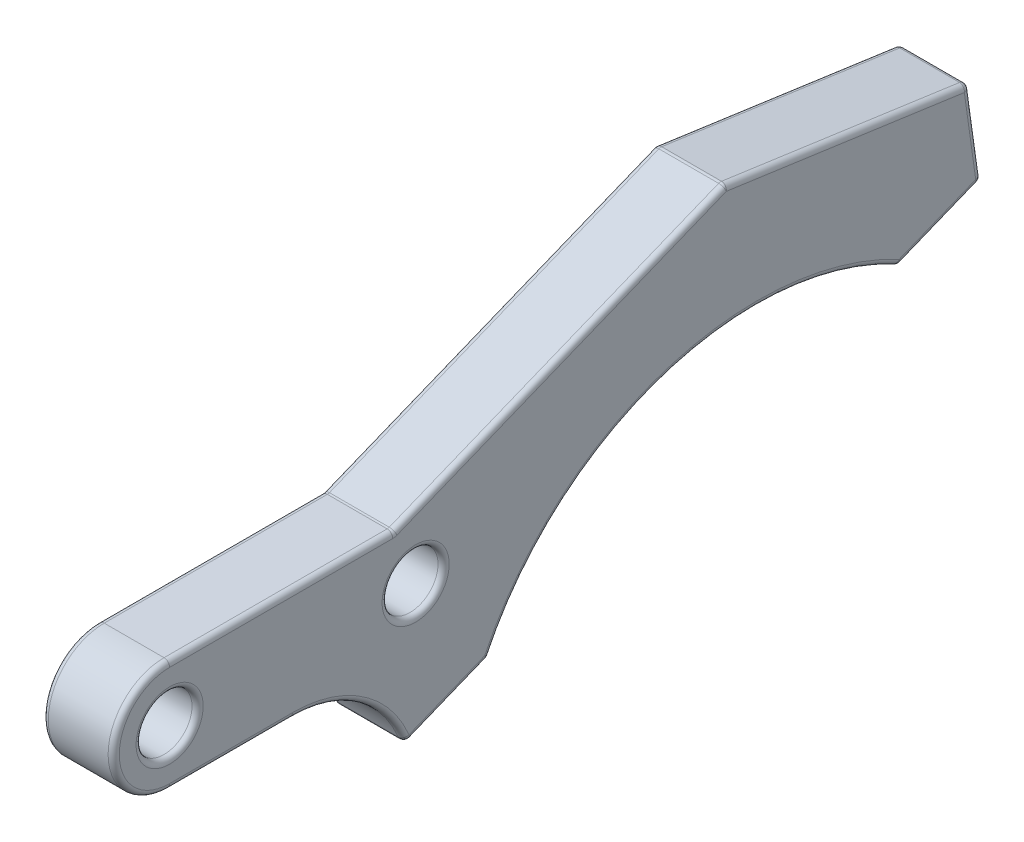
from build123d import *

# Parameters (mm, degrees)
ESBO_O2_R                = 2.5
RESSALTO_EXTRUS_O1_DEPTH = 3.175
FILETE1_R                = 0.5


with BuildPart() as part:
    # Esboço2 → Ressalto-extrusão1 (new, symmetric)
    with BuildSketch(Plane(origin=(0, 0, 0), x_dir=(0, 0, -1), z_dir=(1, 0, 0))):
        with BuildLine():
            Line((-26.516682084, 5), (-6.466682084, 5))
            Line((-6.466682084, 5), (23.203317916, 16.987458121))
            Line((23.203317916, 16.987458121), (44.993317916, 13.925073332))
            Line((44.993317916, 13.925073332), (46.117644593, 5.925073332))
            Line((46.117644593, 5.925073332), (38.700173757, 2.928220585))
            ThreePointArc((38.700173757, 2.928220585), (17.782793868, 4.808335878), (2.024389796, -9.074902795))
            Line((2.024389796, -9.074902795), (-5.39308104, -12.071755542))
            ThreePointArc((-5.39308104, -12.071755542), (-9.342197803, -6.94301071), (-15.516682084, -5))
            Line((-15.516682084, -5), (-26.516682084, -5))
            ThreePointArc((-26.516682084, -5), (-31.516682084, 0), (-26.516682084, 5))
        make_face()
        with Locations((-26.516682084, 0)):
            Circle(ESBO_O2_R, mode=Mode.SUBTRACT)
        with Locations((-4.516682084, 0)):
            Circle(ESBO_O2_R, mode=Mode.SUBTRACT)
    extrude(amount=RESSALTO_EXTRUS_O1_DEPTH, both=True)

    # Filete1
    filete1_edges = [part.edges().sort_by_distance(p)[0] for p in [
        (-3.175, 5, 16.491682084),
        (-3.175, 10.99372906, -8.368317916),
        (-3.175, 15.456265726, -34.098317916),
        (-3.175, 9.925073332, -45.555481255),
        (-3.175, 4.426646959, -42.408909175),
        (-3.175, 4.808335878, -17.782793868),
        (-3.175, -10.573329168, 1.684345622),
        (3.175, -6.94301071, 9.342197803),
        (-3.175, -6.94301071, 9.342197803),
        (-3.175, -5, 21.016682084),
        (-3.175, 0, 31.516682084),
        (3.175, -10.573329168, 1.684345622),
        (0, 5, 6.466682084),
        (0, 16.987458121, -23.203317916),
        (0, 13.925073332, -44.993317916),
        (0, 5.925073332, -46.117644593),
        (0, 2.928220585, -38.700173757),
        (0, -9.074902795, -2.024389796),
        (0, -12.071755542, 5.39308104),
        (3.175, 4.808335878, -17.782793868),
        (3.175, 4.426646959, -42.408909175),
        (3.175, 0, 29.016682084),
        (3.175, 9.925073332, -45.555481255),
        (-3.175, 0, 7.016682084),
        (3.175, 0, 7.016682084),
        (3.175, 15.456265726, -34.098317916),
        (3.175, 10.99372906, -8.368317916),
        (3.175, 5, 16.491682084),
        (3.175, 0, 31.516682084),
        (3.175, -5, 21.016682084),
    ]]
    fillet(filete1_edges, radius=FILETE1_R)


solid = part.part
